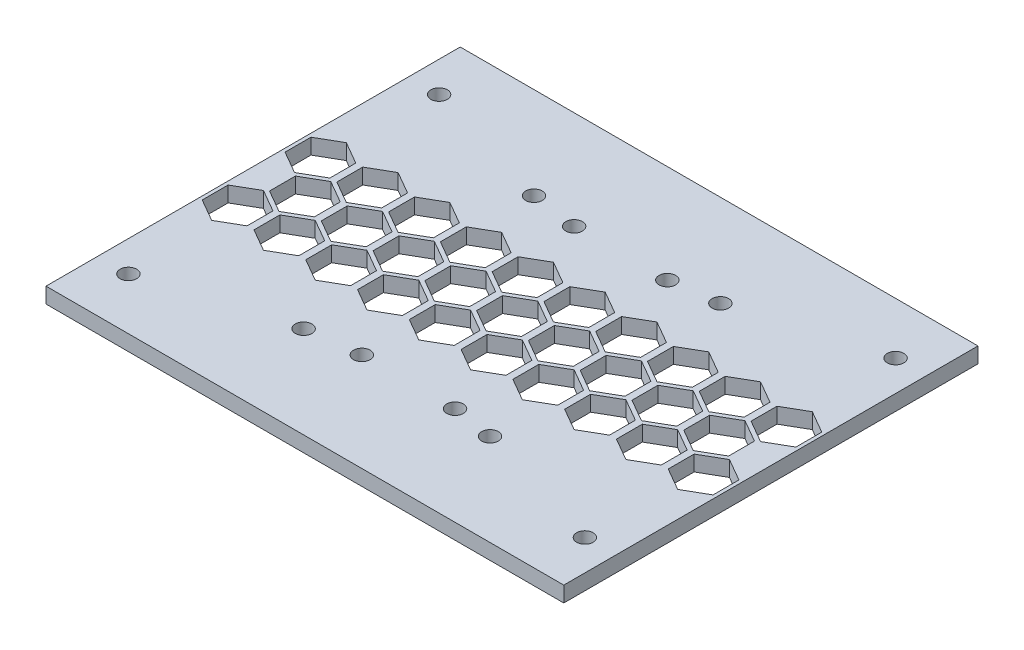
from build123d import *

# Parameters (mm, degrees)
SKETCH_1_W      = 100
SKETCH_1_H      = 80
SKETCH_1_R      = 1.6
EXTRUDE_1_DEPTH = 3


with BuildPart() as part:
    # 草图1 → 凸台-拉伸1 (new body)
    with BuildSketch(Plane(origin=(0, 0, 0), x_dir=(1, 0, 0), z_dir=(0, 1, 0))):
        Rectangle(SKETCH_1_W, SKETCH_1_H)
        with Locations(Location((-18, 22.242640687, 0), (0, 0, 270))):
            Circle(SKETCH_1_R, mode=Mode.SUBTRACT)
        with Locations(Location((18, 22.242640687, 0), (0, 0, 270))):
            Circle(SKETCH_1_R, mode=Mode.SUBTRACT)
        with Locations(Location((-18, -22.242640687, 0), (0, 0, 270))):
            Circle(SKETCH_1_R, mode=Mode.SUBTRACT)
        with Locations(Location((18, -22.242640687, 0), (0, 0, 270))):
            Circle(SKETCH_1_R, mode=Mode.SUBTRACT)
        with Locations(Location((-9, 21, 0), (0, 0, 270))):
            Circle(SKETCH_1_R, mode=Mode.SUBTRACT)
        with Locations(Location((9, 21, 0), (0, 0, 270))):
            Circle(SKETCH_1_R, mode=Mode.SUBTRACT)
        with Locations(Location((10, -21, 0), (0, 0, 270))):
            Circle(SKETCH_1_R, mode=Mode.SUBTRACT)
        with Locations(Location((-8, -21, 0), (0, 0, 270))):
            Circle(SKETCH_1_R, mode=Mode.SUBTRACT)
        with Locations(Location((-44.080756497, 30, 0), (0, 0, 270))):
            Circle(SKETCH_1_R, mode=Mode.SUBTRACT)
        with Locations(Location((44.080756497, 30, 0), (0, 0, 90))):
            Circle(SKETCH_1_R, mode=Mode.SUBTRACT)
        with Locations(Location((-44.080756497, -30, 0), (0, 0, 90))):
            Circle(SKETCH_1_R, mode=Mode.SUBTRACT)
        with Locations(Location((44.080756497, -30, 0), (0, 0, 270))):
            Circle(SKETCH_1_R, mode=Mode.SUBTRACT)
        Polygon((0, 5), (-4.330127019, 2.5), (-4.330127019, -2.5), (0, -5), (4.330127019, -2.5), (4.330127019, 2.5), align=None, mode=Mode.SUBTRACT)
        Polygon((5, -3), (0.669872981, -5.5), (0.669872981, -10.5), (5, -13), (9.330127019, -10.5), (9.330127019, -5.5), align=None, mode=Mode.SUBTRACT)
        Polygon((10, 5), (5.669872981, 2.5), (5.669872981, -2.5), (10, -5), (14.330127019, -2.5), (14.330127019, 2.5), align=None, mode=Mode.SUBTRACT)
        Polygon((20, 5), (15.669872981, 2.5), (15.669872981, -2.5), (20, -5), (24.330127019, -2.5), (24.330127019, 2.5), align=None, mode=Mode.SUBTRACT)
        Polygon((30, 5), (25.669872981, 2.5), (25.669872981, -2.5), (30, -5), (34.330127019, -2.5), (34.330127019, 2.5), align=None, mode=Mode.SUBTRACT)
        Polygon((40, 5), (35.669872981, 2.5), (35.669872981, -2.5), (40, -5), (44.330127019, -2.5), (44.330127019, 2.5), align=None, mode=Mode.SUBTRACT)
        Polygon((-44.330127019, 2.5), (-40, 5), (-35.669872981, 2.5), (-35.669872981, -2.5), (-40, -5), (-44.330127019, -2.5), align=None, mode=Mode.SUBTRACT)
        Polygon((-34.330127019, 2.5), (-30, 5), (-25.669872981, 2.5), (-25.669872981, -2.5), (-30, -5), (-34.330127019, -2.5), align=None, mode=Mode.SUBTRACT)
        Polygon((-24.330127019, 2.5), (-20, 5), (-15.669872981, 2.5), (-15.669872981, -2.5), (-20, -5), (-24.330127019, -2.5), align=None, mode=Mode.SUBTRACT)
        Polygon((-14.330127019, 2.5), (-10, 5), (-5.669872981, 2.5), (-5.669872981, -2.5), (-10, -5), (-14.330127019, -2.5), align=None, mode=Mode.SUBTRACT)
        Polygon((15, -3), (10.669872981, -5.5), (10.669872981, -10.5), (15, -13), (19.330127019, -10.5), (19.330127019, -5.5), align=None, mode=Mode.SUBTRACT)
        Polygon((25, -3), (20.669872981, -5.5), (20.669872981, -10.5), (25, -13), (29.330127019, -10.5), (29.330127019, -5.5), align=None, mode=Mode.SUBTRACT)
        Polygon((35, -3), (30.669872981, -5.5), (30.669872981, -10.5), (35, -13), (39.330127019, -10.5), (39.330127019, -5.5), align=None, mode=Mode.SUBTRACT)
        Polygon((45, -3), (40.669872981, -5.5), (40.669872981, -10.5), (45, -13), (49.330127019, -10.5), (49.330127019, -5.5), align=None, mode=Mode.SUBTRACT)
        Polygon((-49.330127019, -5.5), (-45, -3), (-40.669872981, -5.5), (-40.669872981, -10.5), (-45, -13), (-49.330127019, -10.5), align=None, mode=Mode.SUBTRACT)
        Polygon((-39.330127019, -5.5), (-35, -3), (-30.669872981, -5.5), (-30.669872981, -10.5), (-35, -13), (-39.330127019, -10.5), align=None, mode=Mode.SUBTRACT)
        Polygon((-29.330127019, -5.5), (-25, -3), (-20.669872981, -5.5), (-20.669872981, -10.5), (-25, -13), (-29.330127019, -10.5), align=None, mode=Mode.SUBTRACT)
        Polygon((-19.330127019, -5.5), (-15, -3), (-10.669872981, -5.5), (-10.669872981, -10.5), (-15, -13), (-19.330127019, -10.5), align=None, mode=Mode.SUBTRACT)
        Polygon((-9.330127019, -5.5), (-5, -3), (-0.669872981, -5.5), (-0.669872981, -10.5), (-5, -13), (-9.330127019, -10.5), align=None, mode=Mode.SUBTRACT)
        Polygon((49.330127019, 5.5), (45, 3), (40.669872981, 5.5), (40.669872981, 10.5), (45, 13), (49.330127019, 10.5), align=None, mode=Mode.SUBTRACT)
        Polygon((39.330127019, 5.5), (35, 3), (30.669872981, 5.5), (30.669872981, 10.5), (35, 13), (39.330127019, 10.5), align=None, mode=Mode.SUBTRACT)
        Polygon((29.330127019, 5.5), (25, 3), (20.669872981, 5.5), (20.669872981, 10.5), (25, 13), (29.330127019, 10.5), align=None, mode=Mode.SUBTRACT)
        Polygon((19.330127019, 5.5), (15, 3), (10.669872981, 5.5), (10.669872981, 10.5), (15, 13), (19.330127019, 10.5), align=None, mode=Mode.SUBTRACT)
        Polygon((9.330127019, 5.5), (5, 3), (0.669872981, 5.5), (0.669872981, 10.5), (5, 13), (9.330127019, 10.5), align=None, mode=Mode.SUBTRACT)
        Polygon((-9.330127019, 10.5), (-9.330127019, 5.5), (-5, 3), (-0.669872981, 5.5), (-0.669872981, 10.5), (-5, 13), align=None, mode=Mode.SUBTRACT)
        Polygon((-19.330127019, 10.5), (-19.330127019, 5.5), (-15, 3), (-10.669872981, 5.5), (-10.669872981, 10.5), (-15, 13), align=None, mode=Mode.SUBTRACT)
        Polygon((-29.330127019, 10.5), (-29.330127019, 5.5), (-25, 3), (-20.669872981, 5.5), (-20.669872981, 10.5), (-25, 13), align=None, mode=Mode.SUBTRACT)
        Polygon((-39.330127019, 10.5), (-39.330127019, 5.5), (-35, 3), (-30.669872981, 5.5), (-30.669872981, 10.5), (-35, 13), align=None, mode=Mode.SUBTRACT)
        Polygon((-49.330127019, 10.5), (-49.330127019, 5.5), (-45, 3), (-40.669872981, 5.5), (-40.669872981, 10.5), (-45, 13), align=None, mode=Mode.SUBTRACT)
    extrude(amount=EXTRUDE_1_DEPTH)


solid = part.part
